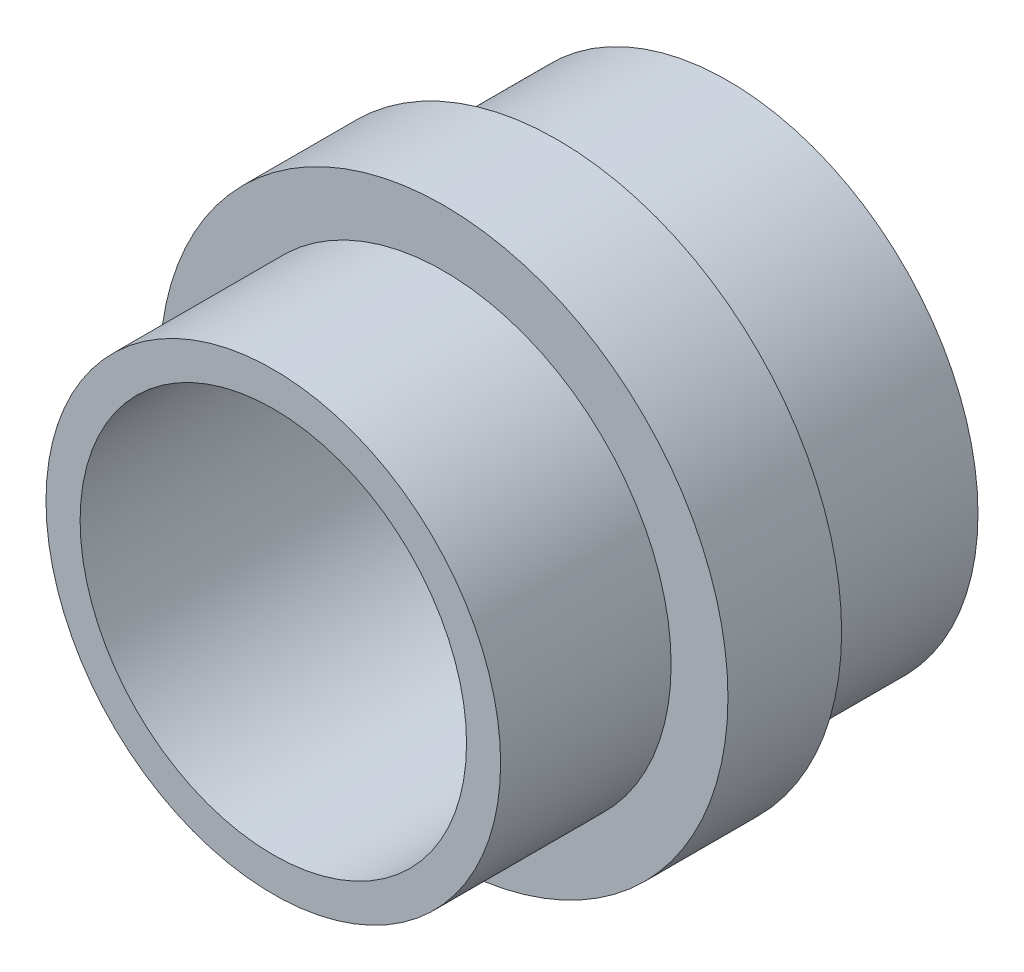
from build123d import *


with BuildPart() as part:
    # Эскиз1 → Повернуть1 (revolve)
    with BuildSketch(Plane(origin=(0, 0, 0), x_dir=(0, 0, -1), z_dir=(1, 0, 0)), mode=Mode.PRIVATE) as revolve_1_sk:
        Polygon((-15, 17), (25, 17), (25, 22), (10, 22), (10, 25), (0, 25), (0, 20), (-15, 20), align=None)
    revolve(revolve_1_sk.sketch.rotate(Axis((0, 0, 1506.992983651), (0, 0, -1)), 90), axis=Axis((0, 0, 1506.992983651), (0, 0, -1)))


solid = part.part
